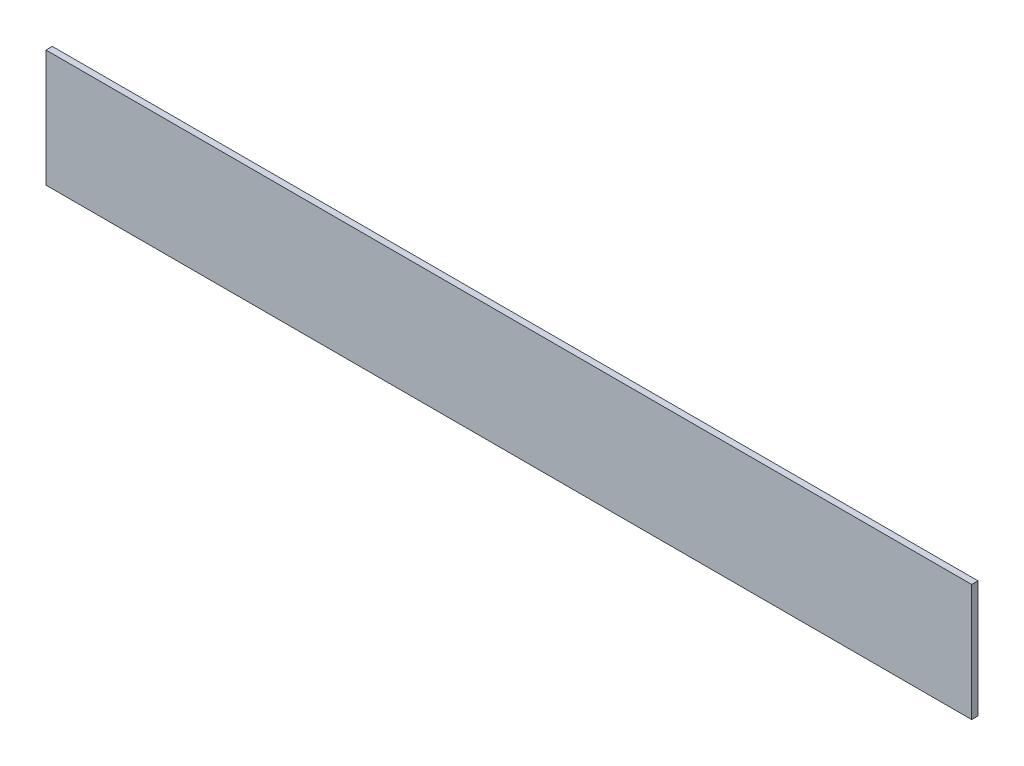
from build123d import *

# Parameters (mm, degrees)
CROQUIS3_W              = 439
CROQUIS3_H              = 55.5
SALIENTE_EXTRUIR3_DEPTH = 3


with BuildPart() as part:
    # Croquis3 → Saliente-Extruir3 (new body)
    with BuildSketch(Plane.XY):
        Rectangle(CROQUIS3_W, CROQUIS3_H)
    extrude(amount=-SALIENTE_EXTRUIR3_DEPTH)


solid = part.part
